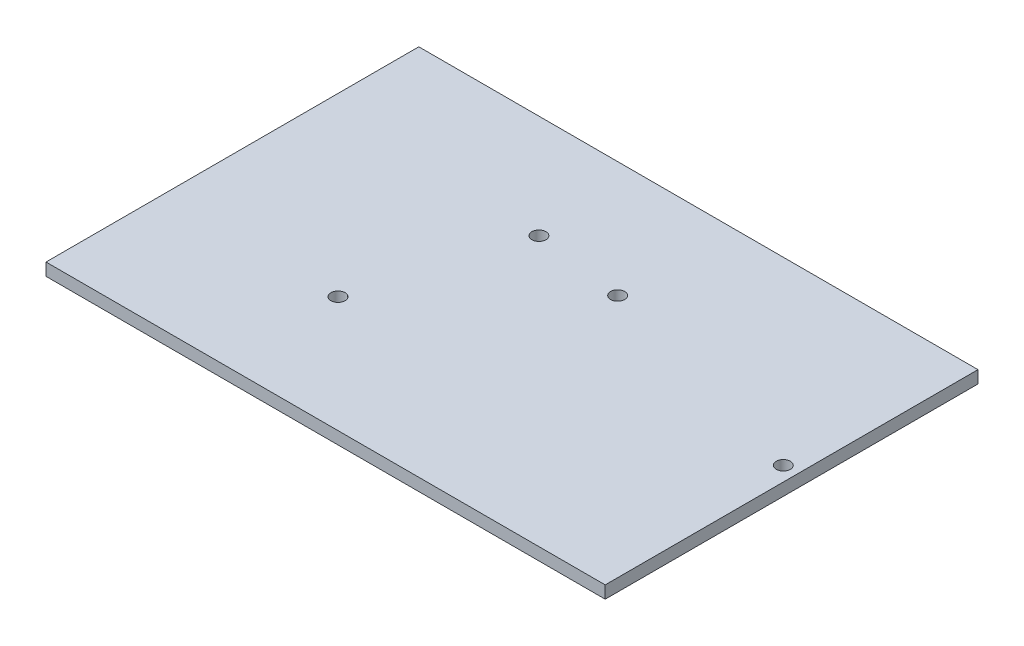
from build123d import *

# Parameters (mm, degrees)
SKIZZE1_W                       = 135
SKIZZE1_H                       = 90
AUFSATZ_LINEAR_AUSTRAGEN1_DEPTH = 3
SKIZZE2_R                       = 1.7
SCHNITT_LINEAR_AUSTRAGEN2_DEPTH = 82.180354766


with BuildPart() as part:
    # Skizze1 → Aufsatz-Linear austragen1 (new body)
    with BuildSketch(Plane(origin=(0, 0, 0), x_dir=(1, 0, 0), z_dir=(0, 1, 0))):
        Rectangle(SKIZZE1_W, SKIZZE1_H)
    extrude(amount=AUFSATZ_LINEAR_AUSTRAGEN1_DEPTH)

    # Skizze2 → Schnitt-Linear austragen2 (cut, through all)
    with BuildSketch(Plane(origin=(0, 3, 0), x_dir=(1, 0, 0), z_dir=(0, 1, 0))):
        with Locations(Location((-13.5, 20, 0), (0, 0, 270))):
            Circle(SKIZZE2_R)
        with Locations(Location((8.5, 17, 0), (0, 0, 270))):
            Circle(SKIZZE2_R)
        with Locations(Location((-25, -17, 0), (0, 0, 270))):
            Circle(SKIZZE2_R)
        with Locations(Location((64, 1.5, 0), (0, 0, 270))):
            Circle(SKIZZE2_R)
    extrude(amount=-SCHNITT_LINEAR_AUSTRAGEN2_DEPTH, mode=Mode.SUBTRACT)


solid = part.part
